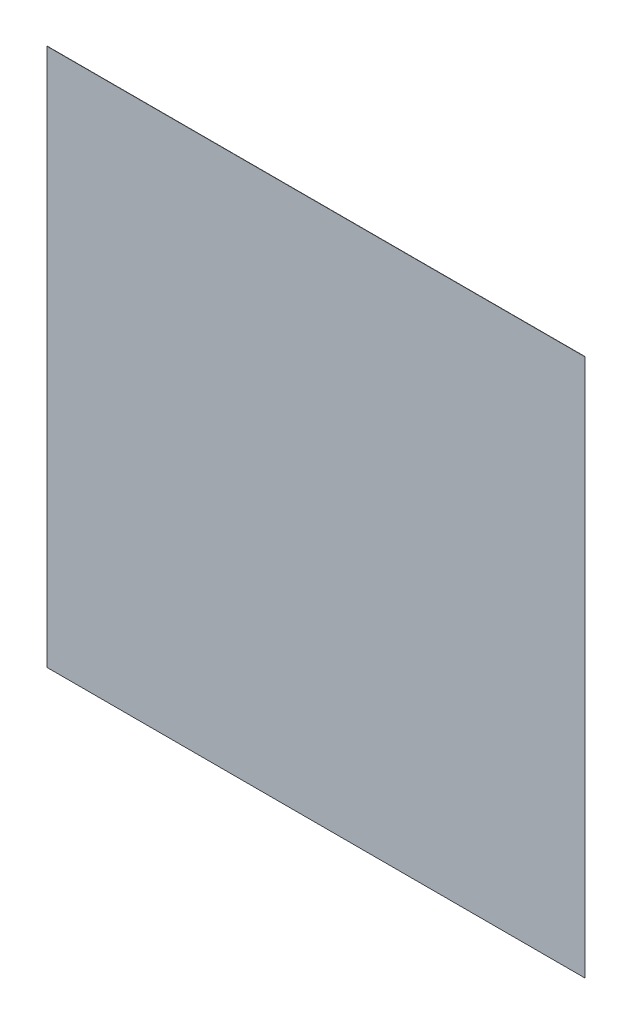
from build123d import *

# Parameters (mm, degrees)
SKETCH_1_W      = 220
SKETCH_1_H      = 220
EXTRUDE_1_DEPTH = 0.1


with BuildPart() as part:
    # 草图1 → 凸台-拉伸1 (new body)
    with BuildSketch(Plane.XY):
        Rectangle(SKETCH_1_W, SKETCH_1_H)
    extrude(amount=EXTRUDE_1_DEPTH)


solid = part.part
